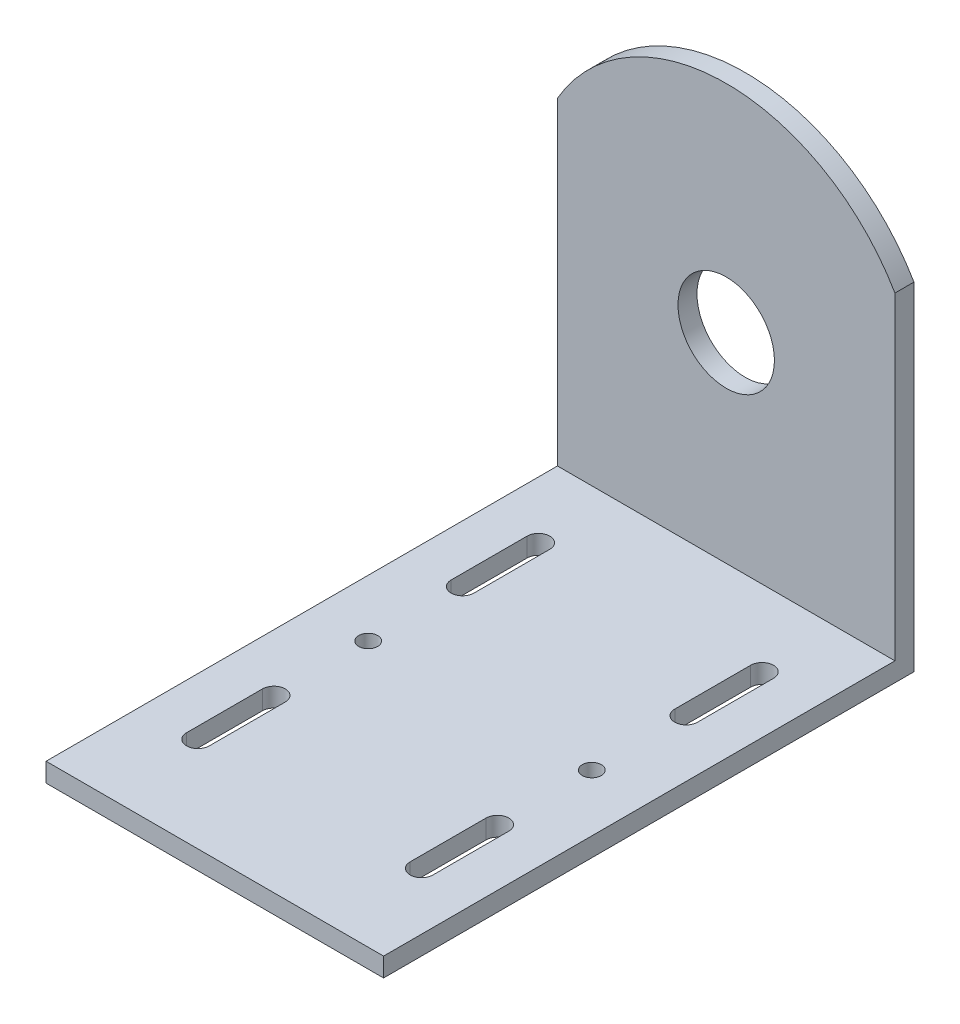
from build123d import *

# Parameters (mm, degrees)
BOSS_EXTRUDE2_DEPTH = 10
BOSS_EXTRUDE3_DEPTH = 10
SKETCH2_R           = 25.4
CUT_EXTRUDE2_DEPTH  = 373.037550256
CUT_EXTRUDE5_DEPTH  = 10
SKETCH4_R           = 5
CUT_EXTRUDE6_DEPTH  = 366.966927049


with BuildPart() as part:
    # 3DSketch1 → Boss-Extrude2 (new body)
    with BuildSketch(Plane(origin=(88.9, 0, 0), x_dir=(-0.5368754921931593, 0, 0.8436614877321076), z_dir=(0, 1, 0))):
        Polygon((0, 0), (235.719019672, 150.003012519), (331.175482184, 0), (95.456462512, -150.003012519), align=None)
    extrude(amount=BOSS_EXTRUDE2_DEPTH)

    # Sketch1 → Boss-Extrude3 (add)
    with BuildSketch(Plane.XY):
        with BuildLine():
            Line((-88.9, 0), (88.9, 0))
            Line((88.9, 0), (88.9, 177.796999188))
            ThreePointArc((88.9, 177.796999188), (0, 229.007355341), (-88.9, 177.796999188))
            Line((-88.9, 177.796999188), (-88.9, 0))
        make_face()
    extrude(amount=BOSS_EXTRUDE3_DEPTH)

    # Sketch2 → Cut-Extrude2 (cut, through all)
    with BuildSketch(Plane(origin=(0, 0, 0), x_dir=(-1, 0, 0), z_dir=(0, 0, -1))):
        with Locations((0, 115.3)):
            Circle(SKETCH2_R)
    extrude(amount=-CUT_EXTRUDE2_DEPTH, mode=Mode.SUBTRACT)

    # Sketch3 → Cut-Extrude5 (cut)
    with BuildSketch(Plane(origin=(0, 10, 0), x_dir=(1, 0, 0), z_dir=(0, 1, 0))):
        with BuildLine():
            Line((-64.9, -90), (-64.9, -50))
            ThreePointArc((-64.9, -50), (-58.9, -44), (-52.9, -50))
            Line((-52.9, -50), (-52.9, -90))
            ThreePointArc((-52.9, -90), (-58.9, -96), (-64.9, -90))
        make_face()
        with BuildLine():
            Line((64.9, -90), (64.9, -50))
            ThreePointArc((64.9, -50), (58.9, -44), (52.9, -50))
            Line((52.9, -50), (52.9, -90))
            ThreePointArc((52.9, -90), (58.9, -96), (64.9, -90))
        make_face()
        with BuildLine():
            Line((64.9, -189.4), (64.9, -229.4))
            ThreePointArc((64.9, -229.4), (58.9, -235.4), (52.9, -229.4))
            Line((52.9, -229.4), (52.9, -189.4))
            ThreePointArc((52.9, -189.4), (58.9, -183.4), (64.9, -189.4))
        make_face()
        with BuildLine():
            Line((-64.9, -189.4), (-64.9, -229.4))
            ThreePointArc((-64.9, -229.4), (-58.9, -235.4), (-52.9, -229.4))
            Line((-52.9, -229.4), (-52.9, -189.4))
            ThreePointArc((-52.9, -189.4), (-58.9, -183.4), (-64.9, -189.4))
        make_face()
    extrude(amount=-CUT_EXTRUDE5_DEPTH, mode=Mode.SUBTRACT)

    # Sketch4 → Cut-Extrude6 (cut, through all)
    with BuildSketch(Plane(origin=(0, 10, 0), x_dir=(1, 0, 0), z_dir=(0, 1, 0))):
        with Locations(Location((-58.9, -139.7, 0), (0, 0, 270))):
            Circle(SKETCH4_R)
        with Locations(Location((58.9, -139.7, 0), (0, 0, 270))):
            Circle(SKETCH4_R)
    extrude(amount=-CUT_EXTRUDE6_DEPTH, mode=Mode.SUBTRACT)


solid = part.part
